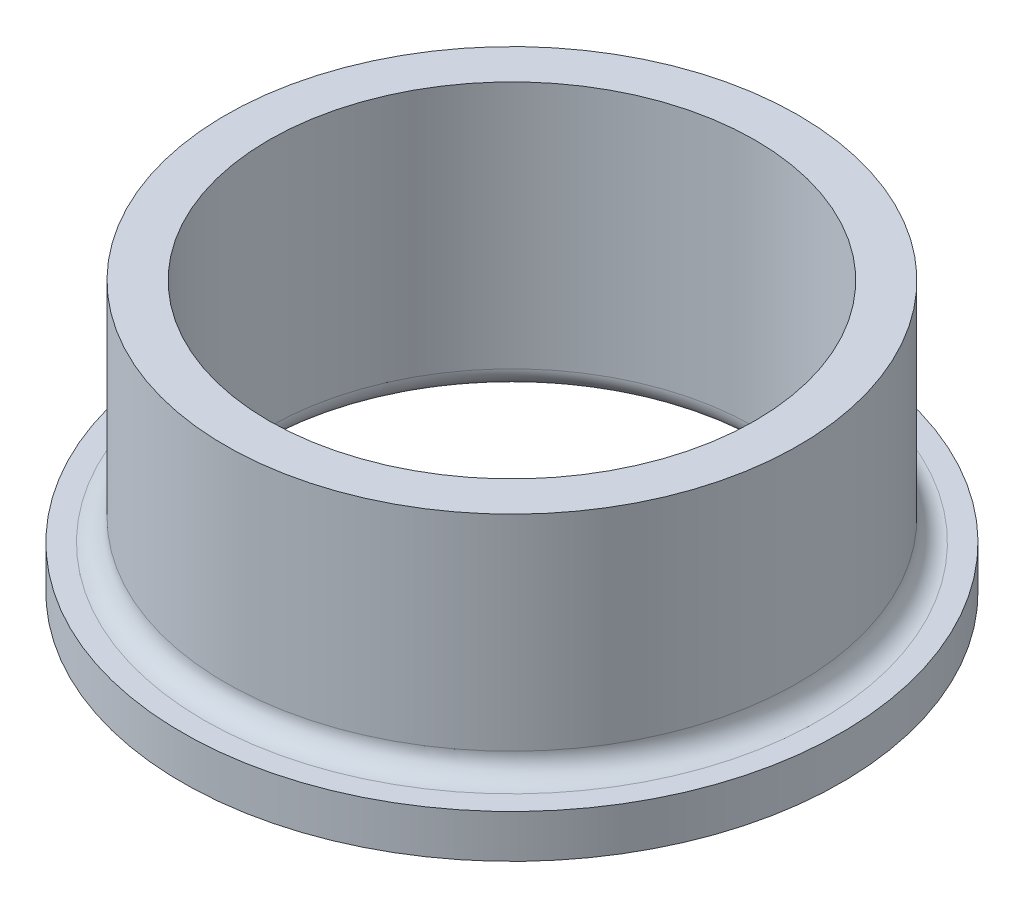
from build123d import *


with BuildPart() as part:
    # Sketch1 → Revolve1 (revolve)
    with BuildSketch(Plane.XY, mode=Mode.PRIVATE) as revolve1_sk:
        with BuildLine():
            Line((22.5, 25), (22.5, 2))
            ThreePointArc((22.5, 2), (23.085786438, 0.585786438), (24.5, 0))
            Line((24.5, 0), (30.5, 0))
            Line((30.5, 0), (30.5, 4))
            Line((30.5, 4), (28.5, 4))
            ThreePointArc((28.5, 4), (27.085786438, 4.585786438), (26.5, 6))
            Line((26.5, 6), (26.5, 25))
            Line((26.5, 25), (22.5, 25))
        make_face()
    revolve(revolve1_sk.sketch.rotate(Axis((0, 0, 0), (0, 1, 0)), 90), axis=Axis((0, 0, 0), (0, 1, 0)))


solid = part.part
